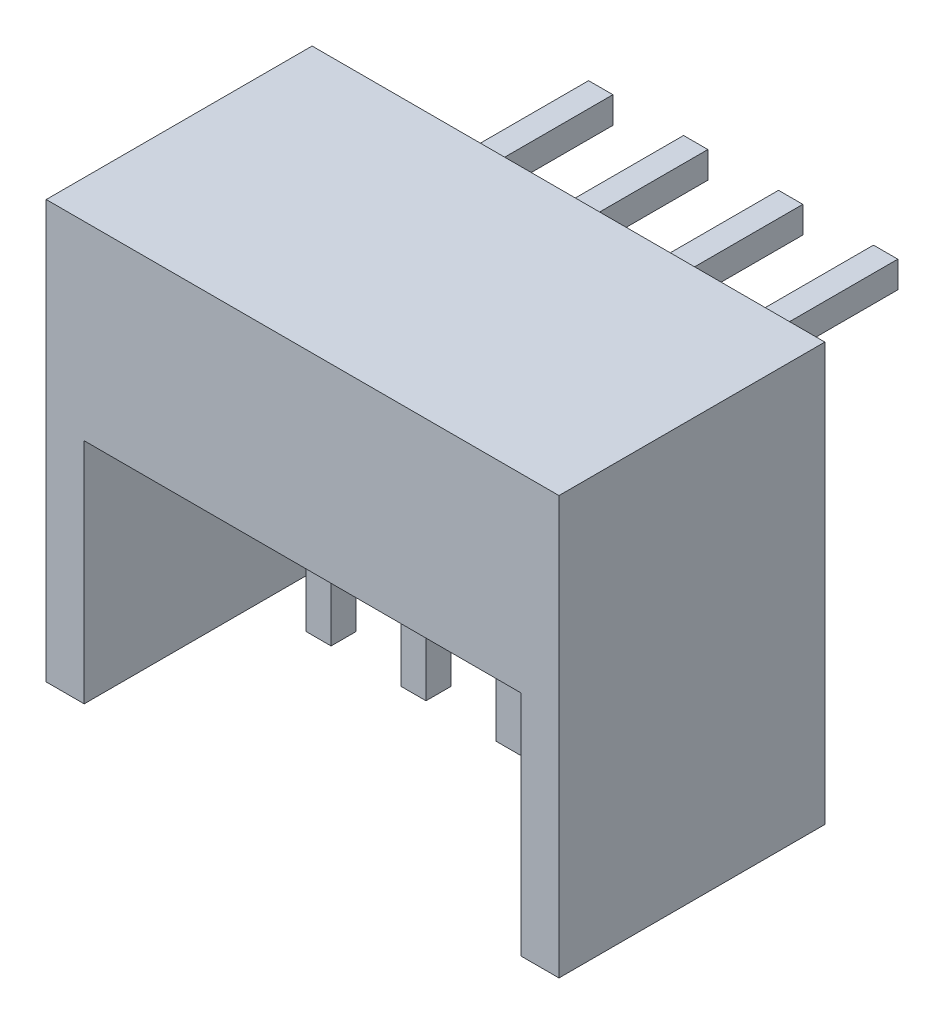
from build123d import *

# Parameters (mm, degrees)
SKETCH_1_W                 = 6.75
SKETCH_1_H                 = 5.5
EXTRUDE_1_DEPTH            = 3.5
SKETCH_2_W                 = 0.32
SKETCH_2_H                 = 0.35
EXTRUDE_2_DEPTH            = 2.3
SKETCH_3_W                 = 5.75
SKETCH_3_H                 = 3
CUT_EXTRUDE_1_DEPTH        = 3
SKETCH_4_W                 = 0.33
SKETCH_4_H                 = 0.33
EXTRUDE_3_DEPTH            = 2.8
PATTERN_LINEAR_3_COUNT     = 2
PATTERN_LINEAR_3_PITCH     = 1.25
PATTERN_LINEAR_3_COL_COUNT = 3
PATTERN_LINEAR_3_COL_PITCH = 1.25


with BuildPart() as part:
    # Эскиз1 → Бобышка-Вытянуть1 (new body)
    with BuildSketch(Plane.XY):
        with Locations((0, 2.75)):
            Rectangle(SKETCH_1_W, SKETCH_1_H)
    extrude(amount=EXTRUDE_1_DEPTH)

    # Эскиз2 → Бобышка-Вытянуть2 (add)
    with BuildSketch(Plane(origin=(0, 0, 0), x_dir=(-1, 0, 0), z_dir=(0, 0, -1))):
        with Locations((-0.625, 4.45)):
            Rectangle(SKETCH_2_W, SKETCH_2_H)
    extrude_2 = extrude(amount=EXTRUDE_2_DEPTH)

    # Эскиз3 → Вырез-Вытянуть1 (cut)
    with BuildSketch(Plane.XZ):
        with Locations((0, 2)):
            Rectangle(SKETCH_3_W, SKETCH_3_H)
    extrude(amount=-CUT_EXTRUDE_1_DEPTH, mode=Mode.SUBTRACT)

    # Эскиз4 → Бобышка-Вытянуть3 (add)
    with BuildSketch(Plane.XZ.offset(-3)):
        with Locations((0.625, 1.25)):
            Rectangle(SKETCH_4_W, SKETCH_4_H)
    extrude_3 = extrude(amount=EXTRUDE_3_DEPTH)

    # Линейный массив3: Бобышка-Вытянуть2, Бобышка-Вытянуть3 ×2
    with Locations(*[(i * PATTERN_LINEAR_3_PITCH, 0, 0) for i in range(1, PATTERN_LINEAR_3_COUNT)]):
        add(extrude_2)
        add(extrude_3)

    # Линейный массив3 col: Бобышка-Вытянуть2, Бобышка-Вытянуть3 ×3
    with Locations(*[(-i * PATTERN_LINEAR_3_COL_PITCH, 0, 0) for i in range(1, PATTERN_LINEAR_3_COL_COUNT)]):
        add(extrude_2)
        add(extrude_3)


solid = part.part
